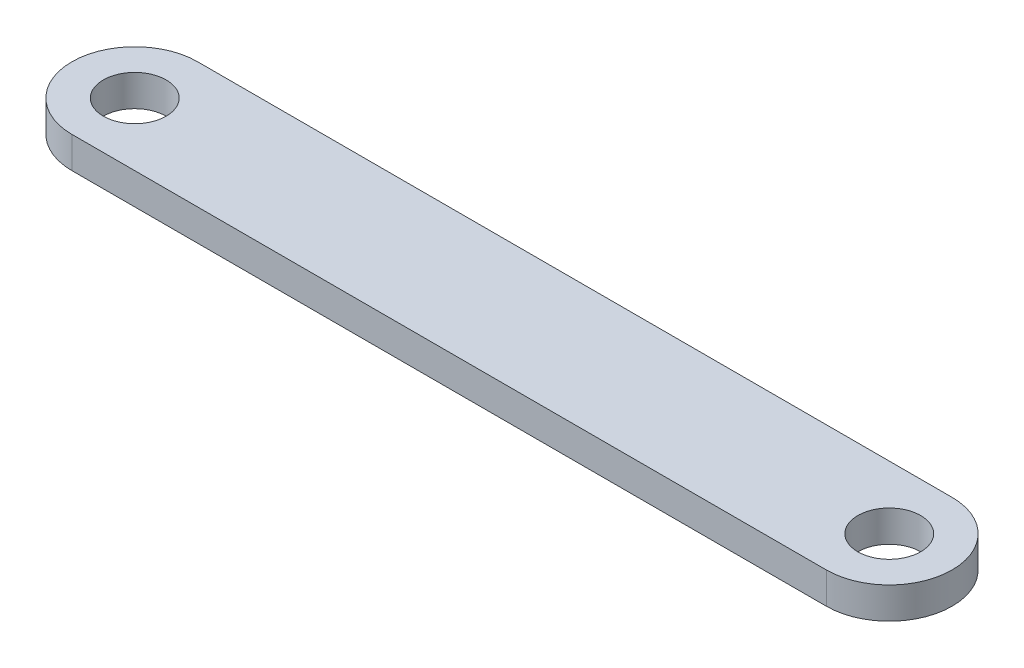
from build123d import *

# Parameters (mm, degrees)
SKETCH1_R           = 5
BOSS_EXTRUDE1_DEPTH = 5


with BuildPart() as part:
    # Sketch1 → Boss-Extrude1 (new body)
    with BuildSketch(Plane(origin=(0, 0, 0), x_dir=(1, 0, 0), z_dir=(0, 1, 0))):
        with BuildLine():
            Line((-60, 10), (60, 10))
            ThreePointArc((60, 10), (70, 0), (60, -10))
            Line((60, -10), (-60, -10))
            ThreePointArc((-60, -10), (-70, 0), (-60, 10))
        make_face()
        with Locations(Location((-60, 0, 0), (0, 0, 270))):
            Circle(SKETCH1_R, mode=Mode.SUBTRACT)
        with Locations(Location((60, 0, 0), (0, 0, 270))):
            Circle(SKETCH1_R, mode=Mode.SUBTRACT)
    extrude(amount=BOSS_EXTRUDE1_DEPTH)


solid = part.part
